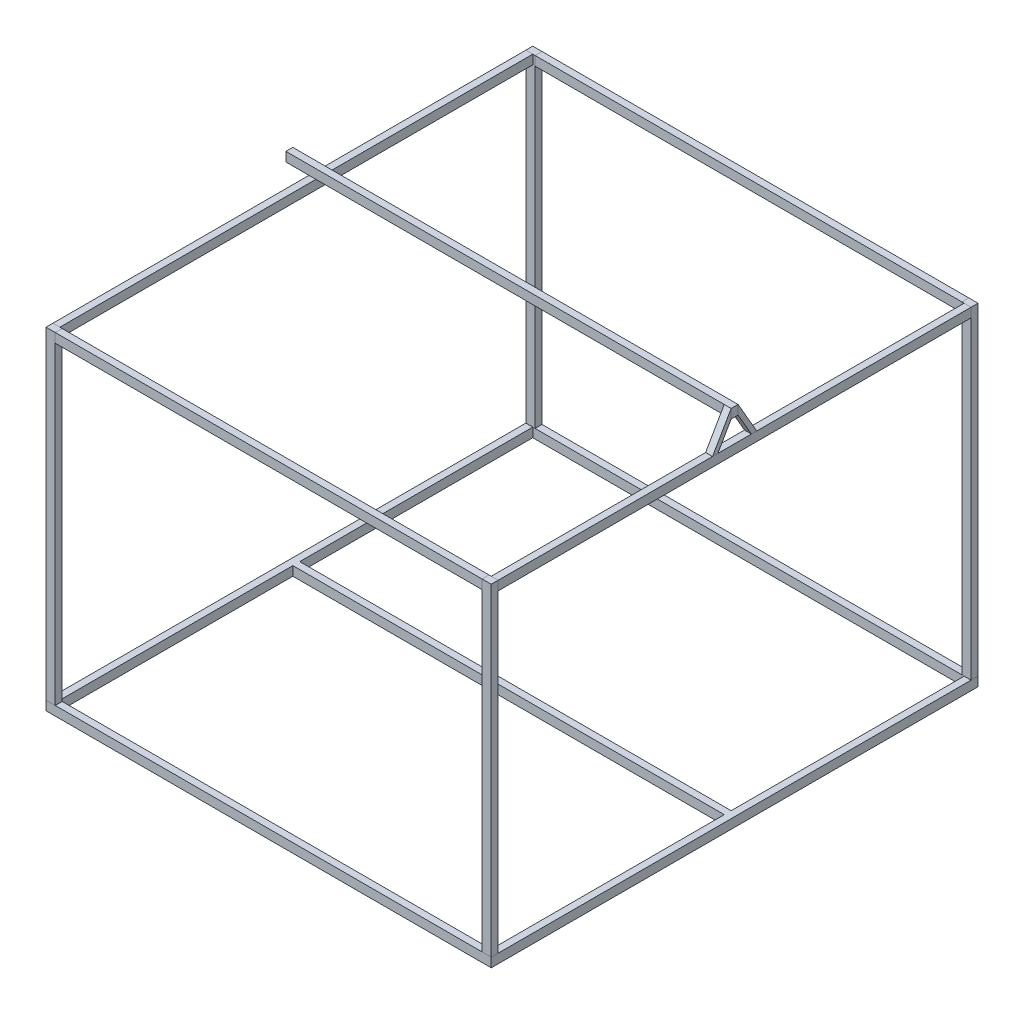
from build123d import *

# Parameters (mm, degrees)
METAL_FRAME_W          = 7720
METAL_FRAME_H          = 4220
METAL_FRAME_W_2        = 7600
METAL_FRAME_H_2        = 2020
METALFRAME_DEPTH       = 80
SKETCH18_W             = 4667.943298929
SKETCH18_H             = 6508.190176391
CUT_EXTRUDE1_DEPTH     = 8718.086669295
SKETCH19_W             = 60
SKETCH19_H             = 4100
BOSS_EXTRUDE1_DEPTH    = 80
BOSS_EXTRUDE5_DEPTH    = 80
BOSS_EXTRUDE5_2_DEPTH  = 80
SKETCH23_3_W           = 2050
SKETCH23_3_H           = 80
BOSS_EXTRUDE6_DEPTH    = 60
BOSS_EXTRUDE7_START    = 3860
BOSS_EXTRUDE7_DEPTH    = 80
BOSS_EXTRUDE7_2_DEPTH  = 80
BOSS_EXTRUDE8_START    = 3860
SKETCH23_6_W           = 2050
SKETCH23_6_H           = 80
BOSS_EXTRUDE8_DEPTH    = 60
SKETCH24_W             = 3700
SKETCH24_H             = 60
BOSS_EXTRUDE9_DEPTH    = 80
BOSS_EXTRUDE9_2_DEPTH  = 80
BOSS_EXTRUDE10_DEPTH   = 60
BOSS_EXTRUDE10_2_DEPTH = 60
SKETCH25_3_W           = 60
SKETCH25_3_H           = 80
BOSS_EXTRUDE11_DEPTH   = 3860


with BuildPart() as part:
    # Metal frame → MetalFrame (new body)
    with BuildSketch(Plane(origin=(0, 0, 0), x_dir=(1, 0, 0), z_dir=(0, 1, 0))):
        with Locations((3800, 2050)):
            Rectangle(METAL_FRAME_W, METAL_FRAME_H)
        with Locations((3800, 1010)):
            Rectangle(METAL_FRAME_W_2, METAL_FRAME_H_2, mode=Mode.SUBTRACT)
        with Locations((3800, 3090)):
            Rectangle(METAL_FRAME_W_2, METAL_FRAME_H_2, mode=Mode.SUBTRACT)
    extrude(amount=-METALFRAME_DEPTH)

    # Sketch18 → Cut-Extrude1 (cut, through all)
    with BuildSketch(Plane(origin=(0, 0, 0), x_dir=(1, 0, 0), z_dir=(0, 1, 0))):
        with Locations((6133.971649464, 2239.218210402)):
            Rectangle(SKETCH18_W, SKETCH18_H)
    extrude(amount=-CUT_EXTRUDE1_DEPTH, mode=Mode.SUBTRACT)

    # Sketch19 → Boss-Extrude1 (add)
    with BuildSketch(Plane(origin=(0, 0, 0), x_dir=(1, 0, 0), z_dir=(0, 1, 0))):
        with Locations((3770, 2050)):
            Rectangle(SKETCH19_W, SKETCH19_H)
    extrude(amount=-BOSS_EXTRUDE1_DEPTH)


with BuildPart() as body_2:
    # Sketch23 → Boss-Extrude5 (new body)
    with BuildSketch(Plane(origin=(-60, 0, 0), x_dir=(0, 0, -1), z_dir=(1, 0, 0))):
        Polygon((4100, 0), (4160, 0), (4160, 2800), (4100, 2800), (4100, 2720), align=None)
    extrude(amount=BOSS_EXTRUDE5_DEPTH)


with BuildPart() as body_3:
    # Sketch23 → Boss-Extrude5 2 (new body)
    with BuildSketch(Plane(origin=(-60, 0, 0), x_dir=(0, 0, -1), z_dir=(1, 0, 0))):
        Polygon((-60, 0), (0, 0), (0, 2720), (0, 2800), (-60, 2800), align=None)
    extrude(amount=BOSS_EXTRUDE5_2_DEPTH)


with BuildPart() as body_4:
    # Sketch23<3> → Boss-Extrude6 (new body)
    with BuildSketch(Plane(origin=(-60, 0, 0), x_dir=(0, 0, -1), z_dir=(1, 0, 0))):
        with Locations((1025, 2760)):
            Rectangle(SKETCH23_3_W, SKETCH23_3_H)
        with Locations((3075, 2760)):
            Rectangle(SKETCH23_3_W, SKETCH23_3_H)
    extrude(amount=BOSS_EXTRUDE6_DEPTH)


with BuildPart() as body_5:
    # Sketch23<5> → Boss-Extrude7 (new body)
    with BuildSketch(Plane(origin=(-60, 0, 0), x_dir=(0, 0, -1), z_dir=(1, 0, 0)).offset(BOSS_EXTRUDE7_START)):
        Polygon((4100, 0), (4160, 0), (4160, 2800), (4100, 2800), (4100, 2720), align=None)
    extrude(amount=-BOSS_EXTRUDE7_DEPTH)


with BuildPart() as body_6:
    # Sketch23<5> → Boss-Extrude7 2 (new body)
    with BuildSketch(Plane(origin=(-60, 0, 0), x_dir=(0, 0, -1), z_dir=(1, 0, 0)).offset(BOSS_EXTRUDE7_START)):
        Polygon((-60, 0), (0, 0), (0, 2720), (0, 2800), (-60, 2800), align=None)
    extrude(amount=-BOSS_EXTRUDE7_2_DEPTH)


with BuildPart() as body_7:
    # Sketch23<6> → Boss-Extrude8 (new body)
    with BuildSketch(Plane(origin=(-60, 0, 0), x_dir=(0, 0, -1), z_dir=(1, 0, 0)).offset(BOSS_EXTRUDE8_START)):
        with Locations((3075, 2760)):
            Rectangle(SKETCH23_6_W, SKETCH23_6_H)
        with Locations((1025, 2760)):
            Rectangle(SKETCH23_6_W, SKETCH23_6_H)
    extrude(amount=-BOSS_EXTRUDE8_DEPTH)


with BuildPart() as body_8:
    # Sketch24 → Boss-Extrude9 (new body)
    with BuildSketch(Plane(origin=(0, 2800, 0), x_dir=(1, 0, 0), z_dir=(0, 1, 0))):
        with Locations((1870, 4130)):
            Rectangle(SKETCH24_W, SKETCH24_H)
    extrude(amount=-BOSS_EXTRUDE9_DEPTH)


with BuildPart() as body_9:
    # Sketch24 → Boss-Extrude9 2 (new body)
    with BuildSketch(Plane(origin=(0, 2800, 0), x_dir=(1, 0, 0), z_dir=(0, 1, 0))):
        with Locations((1870, -30)):
            Rectangle(SKETCH24_W, SKETCH24_H)
    extrude(amount=-BOSS_EXTRUDE9_2_DEPTH)


with BuildPart() as body_10:
    # Sketch25 → Boss-Extrude10 (new body)
    with BuildSketch(Plane(origin=(3800, 0, 0), x_dir=(0, 0, -1), z_dir=(1, 0, 0))):
        Polygon((2020, 3000), (2020, 3080), (1858.341924627, 2800), (1904.529946162, 2800), align=None)
    extrude(amount=-BOSS_EXTRUDE10_DEPTH)


with BuildPart() as body_11:
    # Sketch25 → Boss-Extrude10 2 (new body)
    with BuildSketch(Plane(origin=(3800, 0, 0), x_dir=(0, 0, -1), z_dir=(1, 0, 0))):
        Polygon((2241.658075373, 2800), (2080, 3080), (2080, 3000), (2195.470053838, 2800), align=None)
    extrude(amount=-BOSS_EXTRUDE10_2_DEPTH)


with BuildPart() as body_12:
    # Sketch25<3> → Boss-Extrude11 (new body)
    with BuildSketch(Plane(origin=(3800, 0, 0), x_dir=(0, 0, -1), z_dir=(1, 0, 0))):
        with Locations((2050, 3040)):
            Rectangle(SKETCH25_3_W, SKETCH25_3_H)
    extrude(amount=-BOSS_EXTRUDE11_DEPTH)


solid = Compound([part.part, body_2.part, body_3.part, body_4.part, body_5.part, body_6.part, body_7.part, body_8.part, body_9.part, body_10.part, body_11.part, body_12.part])
